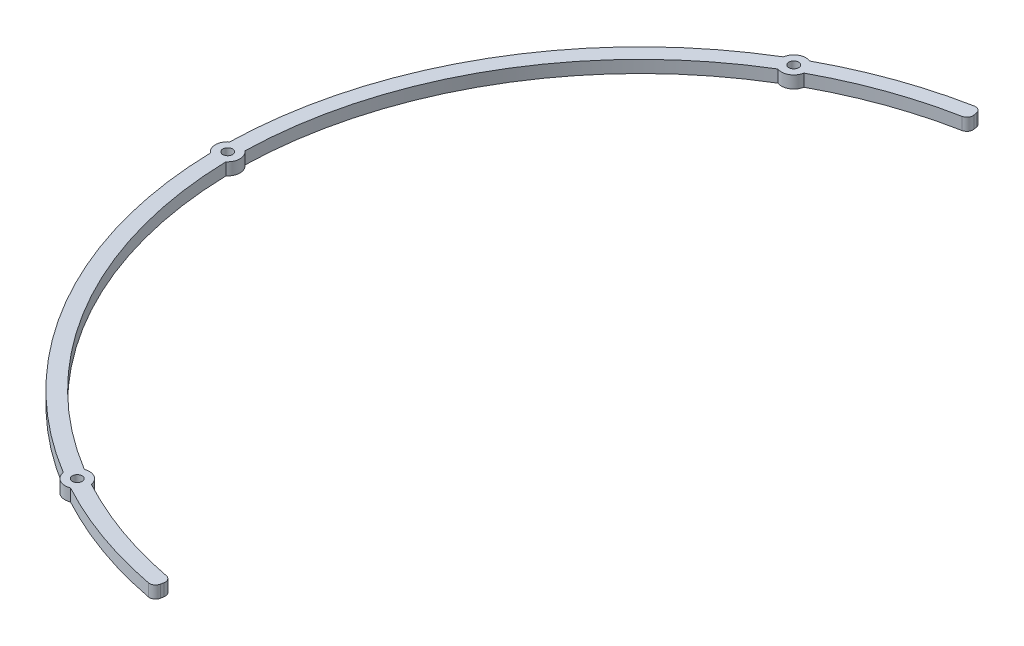
from build123d import *

# Parameters (mm, degrees)
BOSS_EXTRUDE1_DEPTH = 4
FILLET2_R           = 2
CUT_EXTRUDE1_REACH  = 194.09
SKETCH2_R           = 1.6
SKETCH3_R           = 4
SKETCH3_R_2         = 1.6
BOSS_EXTRUDE2_DEPTH = 4


with BuildPart() as part:
    # Sketch1 → Boss-Extrude1 (new body)
    with BuildSketch(Plane(origin=(0, 0, 0), x_dir=(1, 0, 0), z_dir=(0, 1, 0))):
        with BuildLine():
            Line((-22.921559452, -129.994623398), (-23.78980034, -134.918662163))
            ThreePointArc((-23.78980034, -134.918662163), (-137, 0), (-23.78980034, 134.918662163))
            Line((-23.78980034, 134.918662163), (-22.921559452, 129.994623398))
            ThreePointArc((-22.921559452, 129.994623398), (-132, 0), (-22.921559452, -129.994623398))
        make_face()
    extrude(amount=BOSS_EXTRUDE1_DEPTH)

    # Fillet2
    fillet2_edges = [part.edges().sort_by_distance(p)[0] for p in [
        (-23.78980034, 2, -134.918662163),
        (-23.78980034, 2, 134.918662163),
        (-22.921559452, 2, 129.994623398),
        (-22.921559452, 2, -129.994623398),
    ]]
    fillet(fillet2_edges, radius=FILLET2_R)

    # Sketch2 → Cut-Extrude1 (cut, up to next)
    with BuildSketch(Plane(origin=(0, 4, 0), x_dir=(1, 0, 0), z_dir=(0, 1, 0)), mode=Mode.PRIVATE) as cut_extrude1_sk1:
        with Locations(Location((-66.779143443, 116.751, 0), (0, 0, 270))):
            Circle(SKETCH2_R)
    cut_extrude1_tool1 = extrude(cut_extrude1_sk1.sketch, amount=-CUT_EXTRUDE1_REACH, mode=Mode.PRIVATE) & part.part
    # Sketch2 → Cut-Extrude1 (cut, up to next)
    with BuildSketch(Plane(origin=(0, 4, 0), x_dir=(1, 0, 0), z_dir=(0, 1, 0)), mode=Mode.PRIVATE) as cut_extrude1_sk2:
        with Locations(Location((-134.5, 0, 0), (0, 0, 270))):
            Circle(SKETCH2_R)
    cut_extrude1_tool2 = extrude(cut_extrude1_sk2.sketch, amount=-CUT_EXTRUDE1_REACH, mode=Mode.PRIVATE) & part.part
    # Sketch2 → Cut-Extrude1 (cut, up to next)
    with BuildSketch(Plane(origin=(0, 4, 0), x_dir=(1, 0, 0), z_dir=(0, 1, 0)), mode=Mode.PRIVATE) as cut_extrude1_sk3:
        with Locations(Location((-66.779143443, -116.751, 0), (0, 0, 270))):
            Circle(SKETCH2_R)
    cut_extrude1_tool3 = extrude(cut_extrude1_sk3.sketch, amount=-CUT_EXTRUDE1_REACH, mode=Mode.PRIVATE) & part.part
    add(cut_extrude1_tool1.solids().sort_by_distance((-66.779143, 4, -116.751))[0], mode=Mode.SUBTRACT)
    add(cut_extrude1_tool2.solids().sort_by_distance((-134.5, 4, 0))[0], mode=Mode.SUBTRACT)
    add(cut_extrude1_tool3.solids().sort_by_distance((-66.779143, 4, 116.751))[0], mode=Mode.SUBTRACT)

    # Sketch3 → Boss-Extrude2 (add)
    # profile 1 of 3: a face of its own
    with BuildSketch(Plane(origin=(0, 4, 0), x_dir=(1, 0, 0), z_dir=(0, 1, 0))):
        with Locations((-66.779143443, -116.751)):
            Circle(SKETCH3_R)
        with Locations(Location((-66.779143443, -116.751, 0), (0, 0, 270))):
            Circle(SKETCH3_R_2, mode=Mode.SUBTRACT)
    # profile 2 of 3: a face of its own
    with BuildSketch(Plane(origin=(0, 4, 0), x_dir=(1, 0, 0), z_dir=(0, 1, 0))):
        with Locations((-134.5, 0)):
            Circle(SKETCH3_R)
        with Locations(Location((-134.5, 0, 0), (0, 0, 270))):
            Circle(SKETCH3_R_2, mode=Mode.SUBTRACT)
    # profile 3 of 3: a face of its own
    with BuildSketch(Plane(origin=(0, 4, 0), x_dir=(1, 0, 0), z_dir=(0, 1, 0))):
        with Locations((-66.779143443, 116.751)):
            Circle(SKETCH3_R)
        with Locations(Location((-66.779143443, 116.751, 0), (0, 0, 270))):
            Circle(SKETCH3_R_2, mode=Mode.SUBTRACT)
    extrude(amount=-BOSS_EXTRUDE2_DEPTH)


solid = part.part
